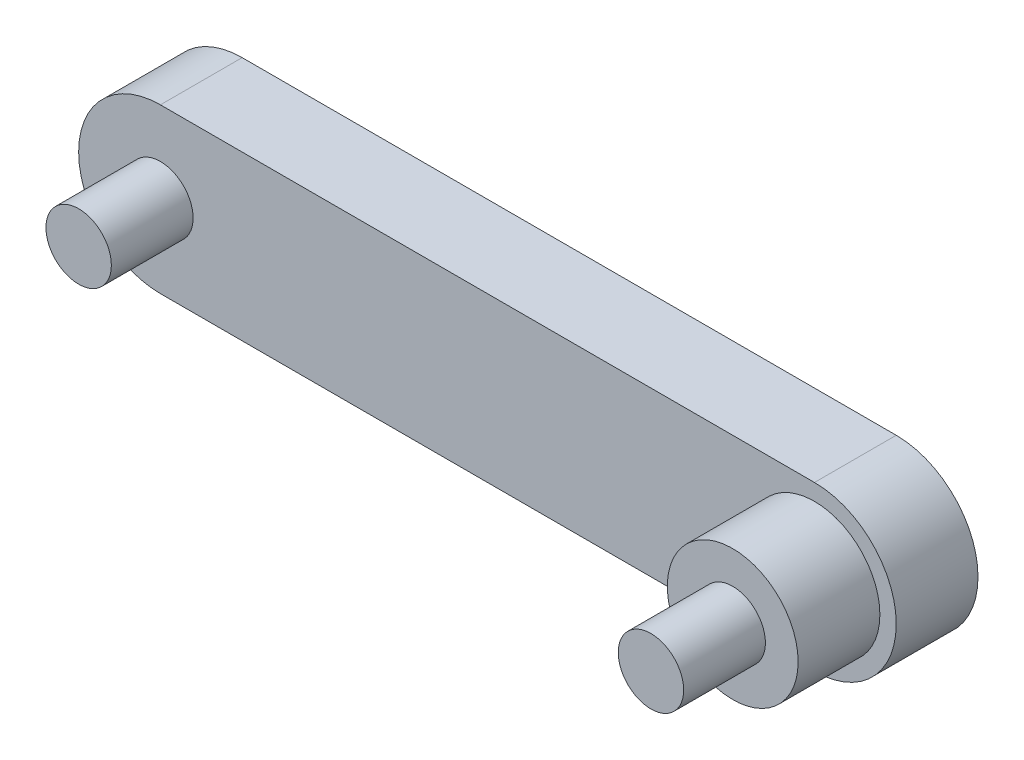
from build123d import *

# Parameters (mm, degrees)
SALIENTE_EXTRUIR1_DEPTH = 5
CROQUIS2_R              = 2
CROQUIS2_R_2            = 4
SALIENTE_EXTRUIR2_DEPTH = 5
CROQUIS3_R              = 2
SALIENTE_EXTRUIR3_DEPTH = 5


with BuildPart() as part:
    # Croquis1 → Saliente-Extruir1 (new body)
    with BuildSketch(Plane.XY):
        with BuildLine():
            Line((-19.085254299, 5.80952381), (20.914745701, 5.80952381))
            ThreePointArc((20.914745701, 5.80952381), (25.914745701, 0.80952381), (20.914745701, -4.19047619))
            Line((20.914745701, -4.19047619), (-19.085254299, -4.19047619))
            ThreePointArc((-19.085254299, -4.19047619), (-24.085254299, 0.80952381), (-19.085254299, 5.80952381))
        make_face()
    extrude(amount=SALIENTE_EXTRUIR1_DEPTH)

    # Croquis2 → Saliente-Extruir2 (add)
    with BuildSketch(Plane.XY.offset(5)):
        with Locations((-19.085254299, 0.80952381)):
            Circle(CROQUIS2_R)
        with Locations((20.914745701, 0.80952381)):
            Circle(CROQUIS2_R_2)
    extrude(amount=SALIENTE_EXTRUIR2_DEPTH)

    # Croquis3 → Saliente-Extruir3 (add)
    with BuildSketch(Plane.XY.offset(10)):
        with Locations((20.914745701, 0.80952381)):
            Circle(CROQUIS3_R)
    extrude(amount=SALIENTE_EXTRUIR3_DEPTH)


solid = part.part
